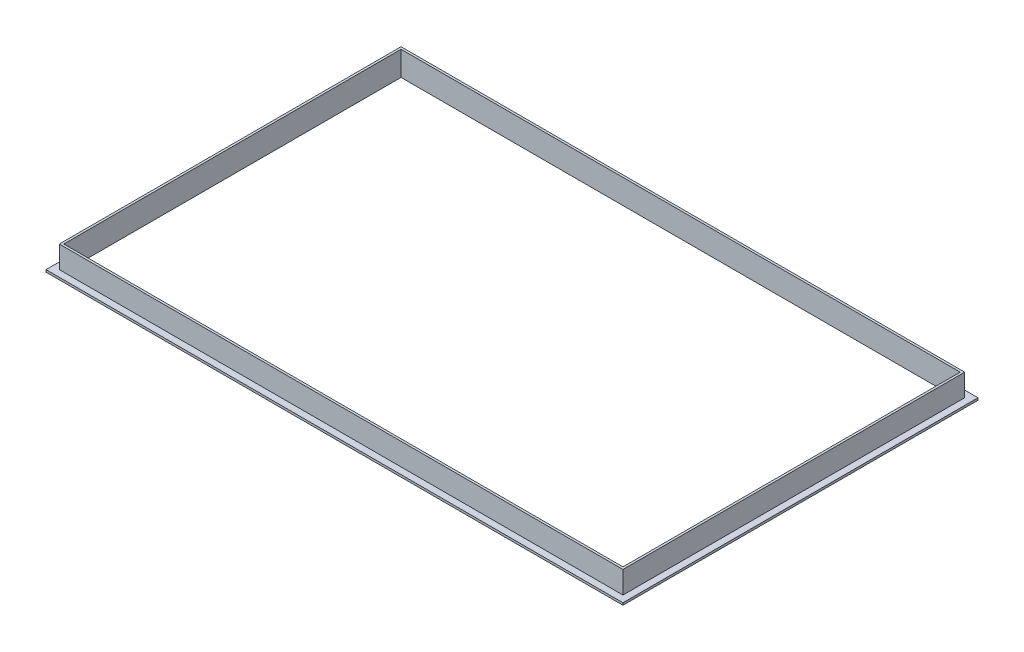
from build123d import *

# Parameters (mm, degrees)
SKIZZE1_W                       = 520
SKIZZE1_H                       = 320
SKIZZE1_W_2                     = 504
SKIZZE1_H_2                     = 304
AUFSATZ_LINEAR_AUSTRAGEN1_DEPTH = 2
SKIZZE2_W                       = 508
SKIZZE2_H                       = 308
SKIZZE2_W_2                     = 504
SKIZZE2_H_2                     = 304
AUFSATZ_LINEAR_AUSTRAGEN2_DEPTH = 20


with BuildPart() as part:
    # Skizze1 → Aufsatz-Linear austragen1 (new body)
    with BuildSketch(Plane(origin=(0, 0, 0), x_dir=(1, 0, 0), z_dir=(0, 1, 0))):
        with Locations((260, 160)):
            Rectangle(SKIZZE1_W, SKIZZE1_H)
        with Locations((260, 160)):
            Rectangle(SKIZZE1_W_2, SKIZZE1_H_2, mode=Mode.SUBTRACT)
    extrude(amount=AUFSATZ_LINEAR_AUSTRAGEN1_DEPTH)

    # Skizze2 → Aufsatz-Linear austragen2 (add)
    with BuildSketch(Plane(origin=(0, 2, 0), x_dir=(1, 0, 0), z_dir=(0, 1, 0))):
        with Locations((260, 160)):
            Rectangle(SKIZZE2_W, SKIZZE2_H)
        with Locations((260, 160)):
            Rectangle(SKIZZE2_W_2, SKIZZE2_H_2, mode=Mode.SUBTRACT)
    extrude(amount=AUFSATZ_LINEAR_AUSTRAGEN2_DEPTH)


solid = part.part
